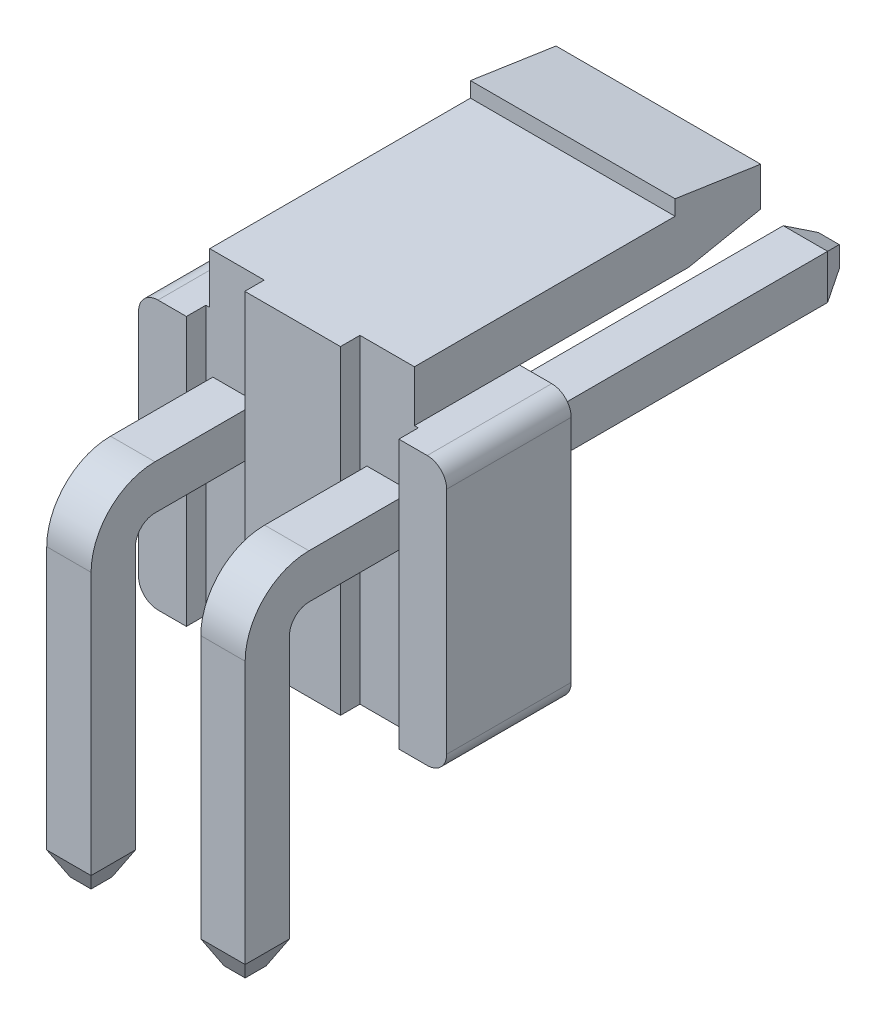
from build123d import *
from OCP.BRepFilletAPI import BRepFilletAPI_MakeChamfer

# Parameters (mm, degrees)
BOSS_EXTRUDE1_DEPTH     = 0.57
CHAMFER1_SIZE           = 0.6
CHAMFER1_SIZE2          = 0.3
SKETCH3_W               = 1.14
SKETCH3_H               = 1.14
BOSS_EXTRUDE2_DEPTH     = 3.2
BOSS_EXTRUDE3_DEPTH     = 2.63
CUT_EXTRUDE1_DEPTH      = 16.128833399
CUT_EXTRUDE1_DEPTH_BACK = 16.128833399
SKETCH4_W               = 1.5
SKETCH4_H               = 0.5


with BuildPart() as part:
    # Sketch2 → Boss-Extrude1 (new, symmetric)
    with BuildSketch(Plane(origin=(1.98, 0, 0), x_dir=(0, 0, -1), z_dir=(1, 0, 0))):
        with BuildLine():
            Line((-2.63, -3.6), (-2.63, 3.75))
            ThreePointArc((-2.63, 3.75), (-2.483553391, 4.103553391), (-2.13, 4.25))
            Line((-2.13, 4.25), (11.8, 4.25))
            Line((11.8, 4.25), (11.8, 5.39))
            Line((11.8, 5.39), (-2.13, 5.39))
            ThreePointArc((-2.13, 5.39), (-3.289655121, 4.909655121), (-3.77, 3.75))
            Line((-3.77, 3.75), (-3.77, -3.6))
            Line((-3.77, -3.6), (-2.63, -3.6))
        make_face()
    extrude(amount=BOSS_EXTRUDE1_DEPTH, both=True)

    # Chamfer1: one chamfer whose edges measure the first distance from different faces: ONE call of the kernel's chamfer builder (chamfer() names one face for all edges)
    chamfer1_edges_1 = [part.edges().sort_by_distance(p)[0] for p in [
        (1.41, -3.6, 3.2),
        (1.41, 4.82, -11.8),
    ]]
    chamfer1_side_1 = [part.faces().sort_by_distance(p)[0] for p in [
        (1.41, 0.075, 3.590209845),
    ]]
    chamfer1_edges_2 = [part.edges().sort_by_distance(p)[0] for p in [
        (1.98, -3.6, 3.77),
    ]]
    chamfer1_side_2 = [part.faces().sort_by_distance(p)[0] for p in [
        (1.98, 0.075, 3.77),
    ]]
    chamfer1_edges_3 = [part.edges().sort_by_distance(p)[0] for p in [
        (1.98, 5.39, -11.8),
    ]]
    chamfer1_side_3 = [part.faces().sort_by_distance(p)[0] for p in [
        (1.98, 5.39, -4.835),
    ]]
    chamfer1_edges_4 = [part.edges().sort_by_distance(p)[0] for p in [
        (1.98, 4.25, -11.8),
    ]]
    chamfer1_side_4 = [part.faces().sort_by_distance(p)[0] for p in [
        (1.98, 4.25, -4.835),
    ]]
    chamfer1_edges_5 = [part.edges().sort_by_distance(p)[0] for p in [
        (1.98, -3.6, 2.63),
    ]]
    chamfer1_side_5 = [part.faces().sort_by_distance(p)[0] for p in [
        (1.98, 0.075, 2.63),
    ]]
    chamfer1_edges_6 = [part.edges().sort_by_distance(p)[0] for p in [
        (2.55, 4.82, -11.8),
        (2.55, -3.6, 3.2),
    ]]
    chamfer1_side_6 = [part.faces().sort_by_distance(p)[0] for p in [
        (2.55, 0.075, 3.590209845),
    ]]
    chamfer1 = BRepFilletAPI_MakeChamfer(part.part.solid().wrapped)
    for e in chamfer1_edges_1:
        chamfer1.Add(CHAMFER1_SIZE, CHAMFER1_SIZE2, e.wrapped, chamfer1_side_1[0].wrapped)  # the first distance lies on this face
    for e in chamfer1_edges_2:
        chamfer1.Add(CHAMFER1_SIZE, CHAMFER1_SIZE2, e.wrapped, chamfer1_side_2[0].wrapped)  # the first distance lies on this face
    for e in chamfer1_edges_3:
        chamfer1.Add(CHAMFER1_SIZE, CHAMFER1_SIZE2, e.wrapped, chamfer1_side_3[0].wrapped)  # the first distance lies on this face
    for e in chamfer1_edges_4:
        chamfer1.Add(CHAMFER1_SIZE, CHAMFER1_SIZE2, e.wrapped, chamfer1_side_4[0].wrapped)  # the first distance lies on this face
    for e in chamfer1_edges_5:
        chamfer1.Add(CHAMFER1_SIZE, CHAMFER1_SIZE2, e.wrapped, chamfer1_side_5[0].wrapped)  # the first distance lies on this face
    for e in chamfer1_edges_6:
        chamfer1.Add(CHAMFER1_SIZE, CHAMFER1_SIZE2, e.wrapped, chamfer1_side_6[0].wrapped)  # the first distance lies on this face
    add(Compound.cast(chamfer1.Shape()), mode=Mode.REPLACE)


with BuildPart() as body_2:
    # Mirror2: mirrored copy
    add(part.part.mirror(Plane(origin=(0, 0, 0), x_dir=(0, 0, 1), z_dir=(1, 0, 0))))


with BuildPart() as body_3:
    # Sketch3 → Boss-Extrude2 (new body)
    with BuildSketch(Plane.XY):
        with BuildLine():
            Line((-3.46, 6.9), (3.46, 6.9))
            ThreePointArc((3.46, 6.9), (3.813553391, 6.753553391), (3.96, 6.4))
            Line((3.96, 6.4), (3.96, 0.5))
            ThreePointArc((3.96, 0.5), (3.813553391, 0.146446609), (3.46, 0))
            Line((3.46, 0), (-3.46, 0))
            ThreePointArc((-3.46, 0), (-3.813553391, 0.146446609), (-3.96, 0.5))
            Line((-3.96, 0.5), (-3.96, 6.4))
            ThreePointArc((-3.96, 6.4), (-3.813553391, 6.753553391), (-3.46, 6.9))
        make_face()
        with Locations((-1.98, 4.82)):
            Rectangle(SKETCH3_W, SKETCH3_H, mode=Mode.SUBTRACT)
        with Locations((1.98, 4.82)):
            Rectangle(SKETCH3_W, SKETCH3_H, mode=Mode.SUBTRACT)
    extrude(amount=-BOSS_EXTRUDE2_DEPTH)

    # Sketch6 → Boss-Extrude3 (add, symmetric)
    with BuildSketch(Plane(origin=(0, 0, 0), x_dir=(0, 0, -1), z_dir=(1, 0, 0))):
        Polygon((0, 6.9), (0, 8.21), (7.2, 8.21), (7.2, 8.6), (9.4, 8.27), (9.4, 7.27), (7.55, 6.9), align=None)
    extrude(amount=BOSS_EXTRUDE3_DEPTH, both=True)

    # Sketch4 → Cut-Extrude1 (cut, two sides: drawn at the far end of the back side and taken through both)
    with BuildSketch(Plane(origin=(0, 0, 0), x_dir=(1, 0, 0), z_dir=(0, 1, 0)).offset(-CUT_EXTRUDE1_DEPTH_BACK)):
        with Locations((-1.98, 0.25)):
            Rectangle(SKETCH4_W, SKETCH4_H)
        with Locations((1.98, 0.25)):
            Rectangle(SKETCH4_W, SKETCH4_H)
    extrude(amount=CUT_EXTRUDE1_DEPTH + CUT_EXTRUDE1_DEPTH_BACK, mode=Mode.SUBTRACT)


solid = Compound([part.part, body_2.part, body_3.part])
